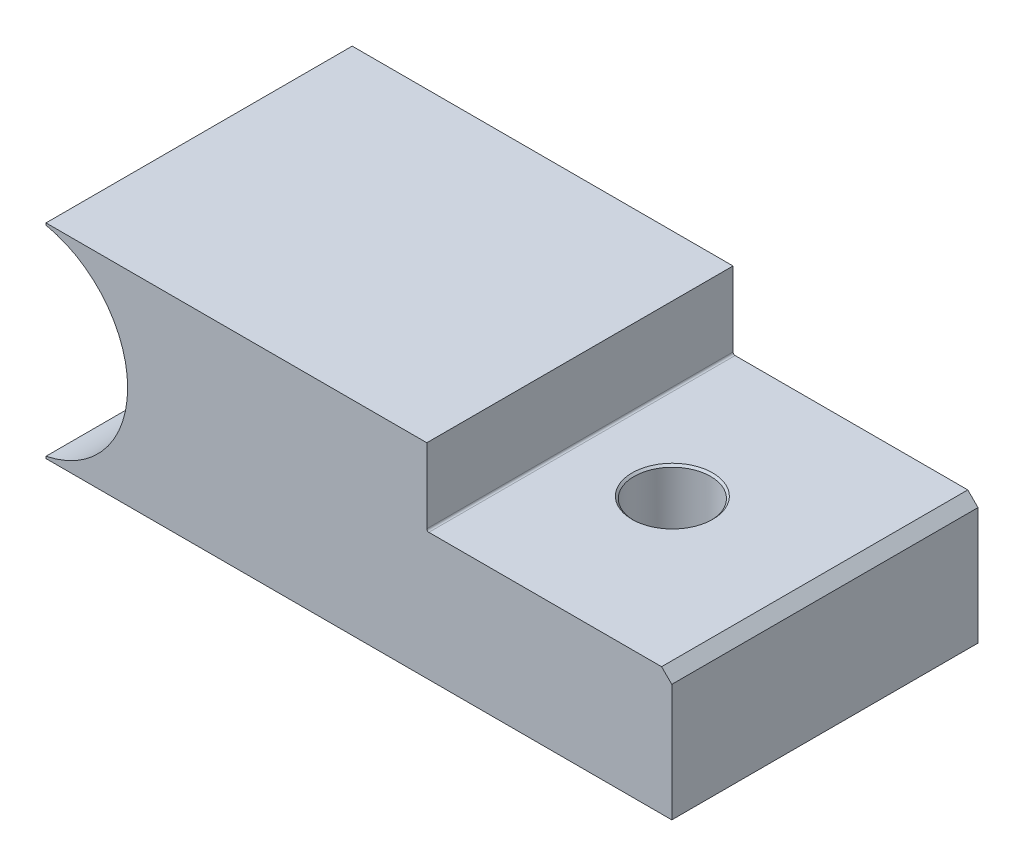
from build123d import *

# Parameters (mm, degrees)
BOSS_EXTRUDE1_DEPTH          = 38.1
F_3_8_0_375_DIAMETER_HOLE1_D = 9.525
CHAMFER1_SIZE                = 1.27
CHAMFER2_SIZE                = 0.254
FILLET1_R                    = 0.254


with BuildPart() as part:
    # Sketch1 → Boss-Extrude1 (new body)
    with BuildSketch(Plane.XY):
        with BuildLine():
            Line((2.54, 0), (80.402581892, 0))
            Line((80.402581892, 0), (80.402581892, 15.875))
            Line((80.402581892, 15.875), (49.922581892, 15.875))
            Line((49.922581892, 15.875), (49.922581892, 25.4))
            Line((49.922581892, 25.4), (2.54, 25.4))
            Line((2.54, 25.4), (2.54, 25.143407893))
            ThreePointArc((2.54, 25.143407893), (12.7, 12.7), (2.54, 0.256592107))
            Line((2.54, 0.256592107), (2.54, 0))
        make_face()
    extrude(amount=BOSS_EXTRUDE1_DEPTH)

    # 3/8 (0.375) Diameter Hole1 (through all)
    with Locations(Plane(origin=(0, 15.875, 0), x_dir=(1, 0, 0), z_dir=(0, 1, 0))):
        with Locations((61.425582, -19.05)):
            Hole(F_3_8_0_375_DIAMETER_HOLE1_D / 2)

    # Chamfer1
    chamfer1_edges = [part.edges().sort_by_distance(p)[0] for p in [
        (80.402581892, 15.875, 19.05),
    ]]
    chamfer(chamfer1_edges, length=CHAMFER1_SIZE)

    # Chamfer2
    chamfer2_edges = [part.edges().sort_by_distance(p)[0] for p in [
        (66.188082, 15.875, 19.05),
    ]]
    chamfer(chamfer2_edges, length=CHAMFER2_SIZE)

    # Fillet1
    fillet1_edges = [part.edges().sort_by_distance(p)[0] for p in [
        (49.922581892, 15.875, 19.05),
    ]]
    fillet(fillet1_edges, radius=FILLET1_R)


solid = part.part
